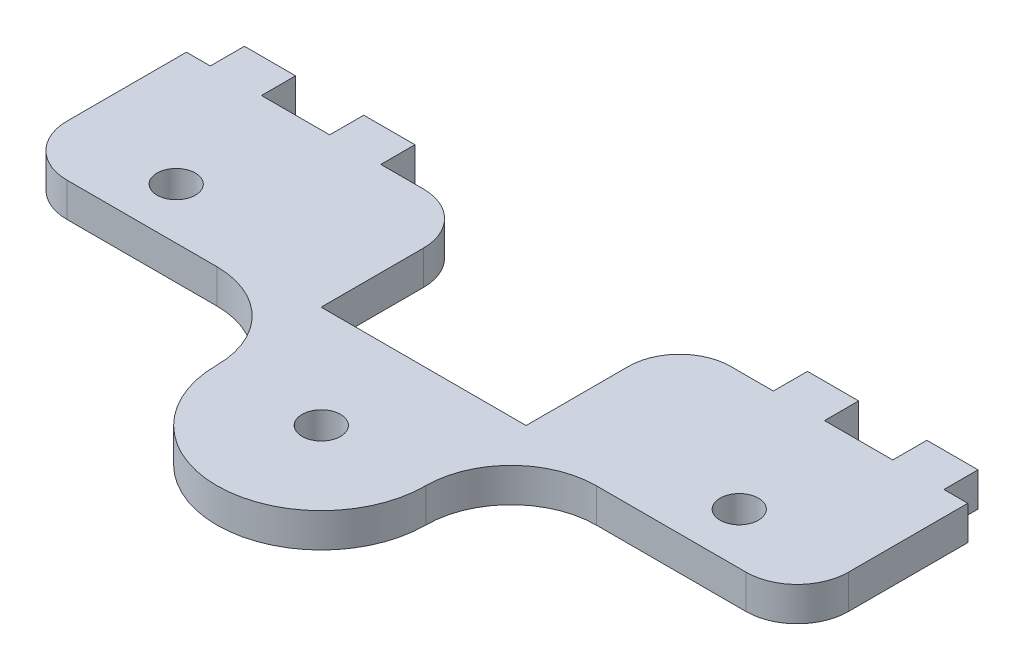
from build123d import *

# Parameters (mm, degrees)
CROQUIS1_R              = 1.125
SALIENTE_EXTRUIR1_DEPTH = 2
CROQUIS3_W              = 7
CROQUIS3_H              = 2.5
SALIENTE_EXTRUIR2_DEPTH = 2


with BuildPart() as part:
    # Croquis1 → Saliente-Extruir1 (new body)
    with BuildSketch(Plane(origin=(0, 0, 0), x_dir=(1, 0, 0), z_dir=(0, 1, 0))):
        with BuildLine():
            Line((19.91, 0), (11.125, 0))
            ThreePointArc((11.125, 0), (7.589466094, -1.464466094), (6.125, -5))
            ThreePointArc((6.125, -5), (0, -11.125), (-6.125, -5))
            ThreePointArc((-6.125, -5), (-7.589466094, -1.464466094), (-11.125, 0))
            Line((-11.125, 0), (-19.91, 0))
            ThreePointArc((-19.91, 0), (-22.031320344, 0.878679656), (-22.91, 3))
            Line((-22.91, 3), (-22.91, 10))
            Line((-22.91, 10), (-21.51, 10))
            Line((-21.51, 10), (-21.51, 12))
            Line((-21.51, 12), (-18.51, 12))
            Line((-18.51, 12), (-18.51, 10))
            Line((-18.51, 10), (-14.51, 10))
            Line((-14.51, 10), (-14.51, 12))
            Line((-14.51, 12), (-11.51, 12))
            Line((-11.51, 12), (-11.51, 10))
            Line((-11.51, 10), (-9.01, 10))
            ThreePointArc((-9.01, 10), (-6.888679656, 9.121320344), (-6.01, 7))
            Line((-6.01, 7), (-6.01, 1))
            Line((-6.01, 1), (6.01, 1))
            Line((6.01, 1), (6.01, 7))
            ThreePointArc((6.01, 7), (6.888679656, 9.121320344), (9.01, 10))
            Line((9.01, 10), (11.51, 10))
            Line((11.51, 10), (11.51, 12))
            Line((11.51, 12), (14.51, 12))
            Line((14.51, 12), (14.51, 10))
            Line((14.51, 10), (18.51, 10))
            Line((18.51, 10), (18.51, 12))
            Line((18.51, 12), (21.51, 12))
            Line((21.51, 12), (21.51, 10))
            Line((21.51, 10), (22.91, 10))
            Line((22.91, 10), (22.91, 3))
            ThreePointArc((22.91, 3), (22.031320344, 0.878679656), (19.91, 0))
        make_face()
        with Locations(Location((-16.51, 3, 0), (0, 0, 270))):
            Circle(CROQUIS1_R, mode=Mode.SUBTRACT)
        with Locations(Location((16.51, 3, 0), (0, 0, 90))):
            Circle(CROQUIS1_R, mode=Mode.SUBTRACT)
        with Locations(Location((0, -5, 0), (0, 0, 270))):
            Circle(CROQUIS1_R, mode=Mode.SUBTRACT)
    extrude(amount=SALIENTE_EXTRUIR1_DEPTH)

    # Croquis3 → Saliente-Extruir2 (add)
    with BuildSketch(Plane.XZ):
        with Locations((-16.51, -6.75)):
            Rectangle(CROQUIS3_W, CROQUIS3_H)
        with Locations((16.51, -6.75)):
            Rectangle(CROQUIS3_W, CROQUIS3_H)
    extrude(amount=SALIENTE_EXTRUIR2_DEPTH)


solid = part.part
